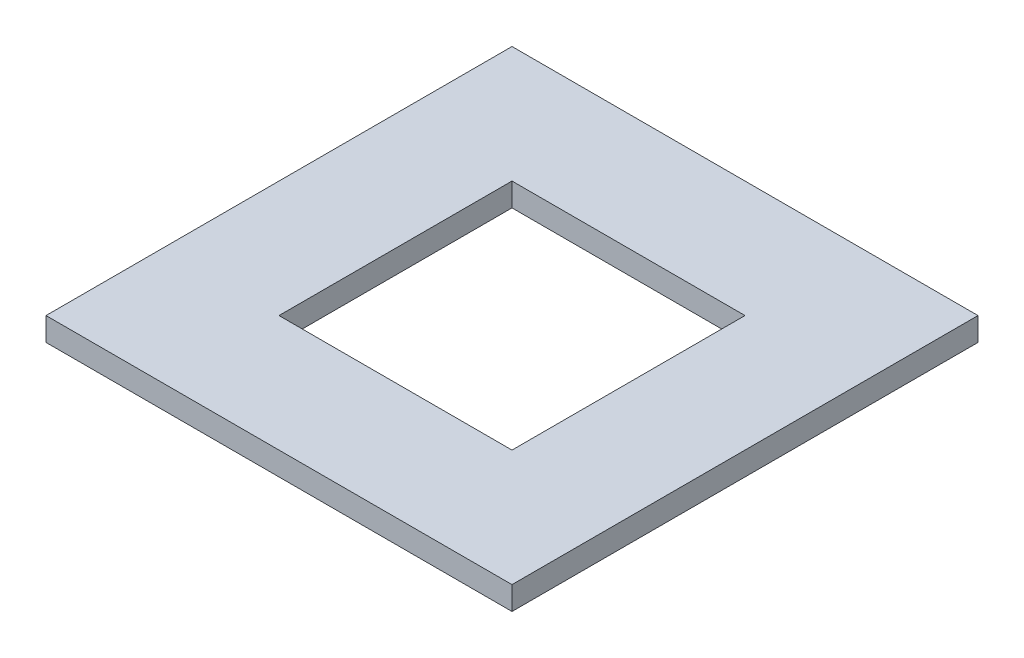
from build123d import *

# Parameters (mm, degrees)
SKETCH1_W           = 200
SKETCH1_H           = 200
SKETCH1_W_2         = 100
SKETCH1_H_2         = 100
BOSS_EXTRUDE1_DEPTH = 10


with BuildPart() as part:
    # Sketch1 → Boss-Extrude1 (new body)
    with BuildSketch(Plane(origin=(0, 0, 0), x_dir=(1, 0, 0), z_dir=(0, 1, 0))):
        Rectangle(SKETCH1_W, SKETCH1_H)
        Rectangle(SKETCH1_W_2, SKETCH1_H_2, mode=Mode.SUBTRACT)
    extrude(amount=BOSS_EXTRUDE1_DEPTH)


solid = part.part
